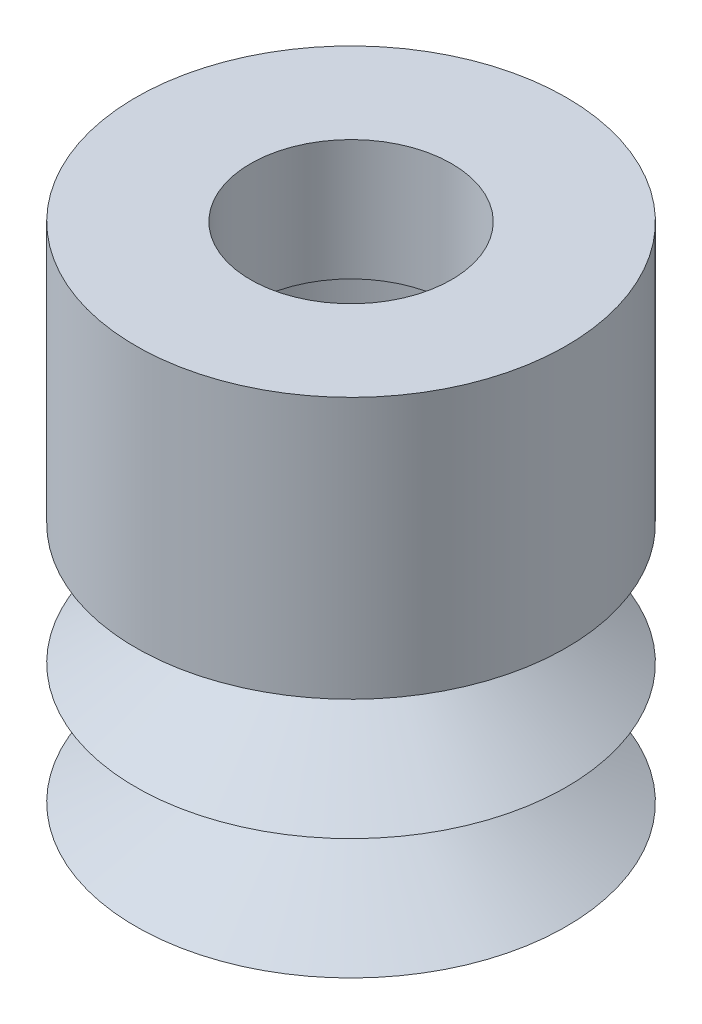
from build123d import *


with BuildPart() as part:
    # Esquisse1 → Révolution1 (revolve)
    with BuildSketch(Plane.XY, mode=Mode.PRIVATE) as r_volution1_sk:
        Polygon((-2.5, 12.5), (-5.35, 12.5), (-5.35, 6), (-2.65, 4.846966679), (-5.35, 3), (-2.65, 1.487737546), (-5.35, 0), (-3.15180726, 0), (-1.050002871, 1.487737546), (-3.750002871, 3), (-2, 4.197109997), (-2, 7.9), (-4, 7.9), (-4, 9.5), (-2.5, 9.5), align=None)
    revolve(r_volution1_sk.sketch.rotate(Axis((0, 0, 0), (0, 1, 0)), 270), axis=Axis((0, 0, 0), (0, 1, 0)))


solid = part.part
